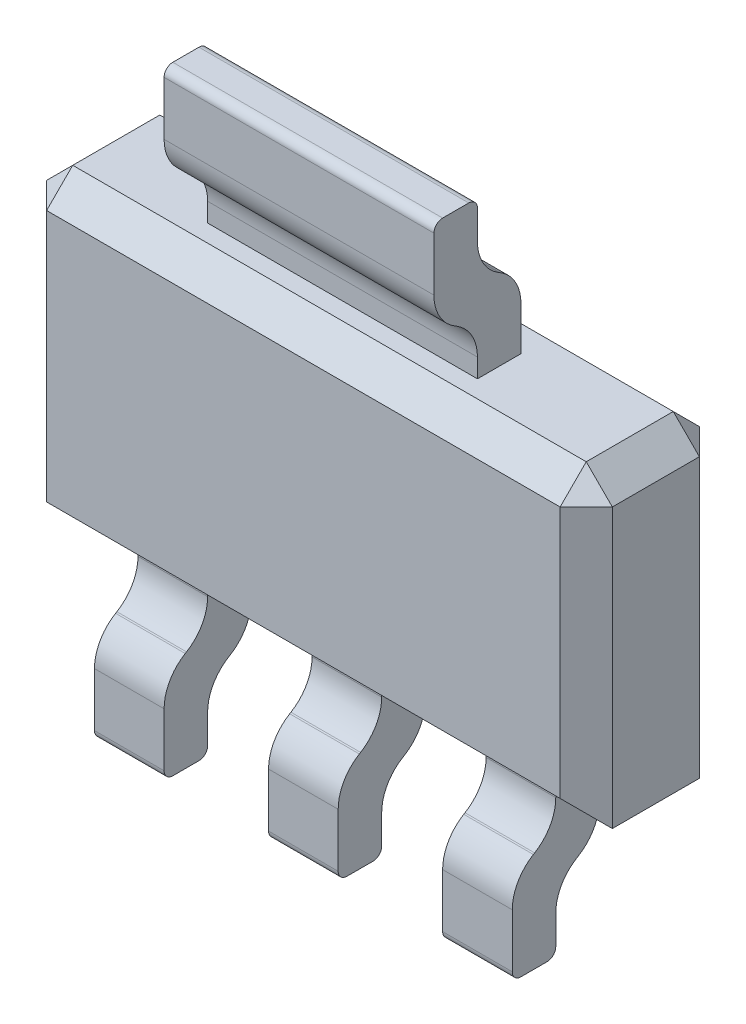
from build123d import *

# Parameters (mm, degrees)
SKETCH1_W                = 6.5
SKETCH1_H                = 3.5
BOSS_EXTRUDE1_DEPTH      = 1.6
CHAMFER1_SIZE            = 0.3
BOSS_EXTRUDE2_DEPTH      = 1.5
BOSS_EXTRUDE2_DEPTH_BACK = 1.6
BOSS_EXTRUDE3_DEPTH      = 0.4
LPATTERN1_COUNT          = 2
LPATTERN1_PITCH          = 2
LPATTERN1_COL_COUNT      = 2
LPATTERN1_COL_PITCH      = 2
CUT_EXTRUDE1_DEPTH       = 0.1


with BuildPart() as part:
    # Sketch1 → Boss-Extrude1 (new body)
    with BuildSketch(Plane.XY):
        Rectangle(SKETCH1_W, SKETCH1_H)
    extrude(amount=BOSS_EXTRUDE1_DEPTH)

    # Chamfer1
    chamfer1_edges = [part.edges().sort_by_distance(p)[0] for p in [
        (-3.25, 0, 1.6),
        (0, -1.75, 1.6),
        (3.25, 0, 1.6),
        (0, -1.75, 0),
        (-3.25, 0, 0),
        (0, 1.75, 0),
        (3.25, 0, 0),
        (0, 1.75, 1.6),
        (-3.25, 1.75, 0.8),
        (3.25, 1.75, 0.8),
    ]]
    chamfer(chamfer1_edges, length=CHAMFER1_SIZE)

    # Sketch2 → Boss-Extrude2 (add, two sides: drawn at the far end of the back side and taken through both)
    with BuildSketch(Plane(origin=(0, 0, 0), x_dir=(0, 0, -1), z_dir=(1, 0, 0)).offset(-BOSS_EXTRUDE2_DEPTH_BACK)):
        with BuildLine():
            Line((-1.1, 1.75), (-1.1, 1.966904811))
            ThreePointArc((-1.1, 1.966904811), (-1.164900047, 2.213254218), (-1.342752122, 2.395651273))
            Line((-1.342752122, 2.395651273), (-1.357247878, 2.404348727))
            ThreePointArc((-1.357247878, 2.404348727), (-1.535099953, 2.586745782), (-1.6, 2.833095189))
            Line((-1.6, 2.833095189), (-1.6, 3.45))
            ThreePointArc((-1.6, 3.45), (-1.570710678, 3.520710678), (-1.5, 3.55))
            Line((-1.5, 3.55), (-1.2, 3.55))
            ThreePointArc((-1.2, 3.55), (-1.129289322, 3.520710678), (-1.1, 3.45))
            Line((-1.1, 3.45), (-1.1, 3.116190379))
            ThreePointArc((-1.1, 3.116190379), (-1.035099953, 2.869840971), (-0.857247878, 2.687443916))
            Line((-0.857247878, 2.687443916), (-0.842752122, 2.678746463))
            ThreePointArc((-0.842752122, 2.678746463), (-0.664900047, 2.496349407), (-0.6, 2.25))
            Line((-0.6, 2.25), (-0.6, 1.75))
            Line((-0.6, 1.75), (-0.3, 1.75))
            Line((-0.3, 1.75), (-0.3, 1.45))
            Line((-0.3, 1.45), (-1.3, 1.45))
            Line((-1.3, 1.45), (-1.3, 1.75))
            Line((-1.3, 1.75), (-1.1, 1.75))
        make_face()
    extrude(amount=BOSS_EXTRUDE2_DEPTH + BOSS_EXTRUDE2_DEPTH_BACK)

    # Sketch3 → Boss-Extrude3 (add, symmetric)
    with BuildSketch(Plane(origin=(0, 0, 0), x_dir=(0, 0, -1), z_dir=(1, 0, 0))):
        with BuildLine():
            Line((-1.1, -1.75), (-1.1, -1.966904811))
            ThreePointArc((-1.1, -1.966904811), (-1.164900047, -2.213254218), (-1.342752122, -2.395651273))
            Line((-1.342752122, -2.395651273), (-1.357247878, -2.404348727))
            ThreePointArc((-1.357247878, -2.404348727), (-1.535099953, -2.586745782), (-1.6, -2.833095189))
            Line((-1.6, -2.833095189), (-1.6, -3.45))
            ThreePointArc((-1.6, -3.45), (-1.570710678, -3.520710678), (-1.5, -3.55))
            Line((-1.5, -3.55), (-1.2, -3.55))
            ThreePointArc((-1.2, -3.55), (-1.129289322, -3.520710678), (-1.1, -3.45))
            Line((-1.1, -3.45), (-1.1, -3.116190379))
            ThreePointArc((-1.1, -3.116190379), (-1.035099953, -2.869840971), (-0.857247878, -2.687443916))
            Line((-0.857247878, -2.687443916), (-0.842752122, -2.678746463))
            ThreePointArc((-0.842752122, -2.678746463), (-0.664900047, -2.496349407), (-0.6, -2.25))
            Line((-0.6, -2.25), (-0.6, -1.75))
            Line((-0.6, -1.75), (-1.1, -1.75))
        make_face()
    boss_extrude3 = extrude(amount=BOSS_EXTRUDE3_DEPTH, both=True)

    # LPattern1: Boss-Extrude3 ×2
    with Locations(*[(-i * LPATTERN1_PITCH, 0, 0) for i in range(1, LPATTERN1_COUNT)]):
        add(boss_extrude3)

    # LPattern1 col: Boss-Extrude3 ×2
    with Locations(*[(i * LPATTERN1_COL_PITCH, 0, 0) for i in range(1, LPATTERN1_COL_COUNT)]):
        add(boss_extrude3)

    # Sketch4 → Cut-Extrude1 (cut)
    # profile 1 of 3: a face of its own
    with BuildSketch(Plane(origin=(0, 0, 0), x_dir=(-1, 0, 0), z_dir=(0, 0, -1))):
        with BuildLine():
            Line((-1.920472746, 0.924352242), (-2.014423067, 0.900714422))
            add(Edge.make_bspline(
                [(-2.014423067, 0.900714422), (-2.018053046, 0.912054357), (-2.025111092, 0.93410346), (-2.040568495, 0.964324102), (-2.059024038, 0.991052392), (-2.080966519, 1.013296323), (-2.1044605, 1.031668686), (-2.129642594, 1.044767543), (-2.155798345, 1.053058927), (-2.173752902, 1.054061436), (-2.182692297, 1.054560576)],
                knots=[0, 0, 0, 0, 1.168138113, 2.271300134, 3.321476528, 4.346768605, 5.329559432, 6.239186739, 7.123308644, 8, 8, 8, 8], degree=3))
            add(Edge.make_bspline(
                [(-2.182692297, 1.054560576), (-2.192290177, 1.054141307), (-2.210781227, 1.053333553), (-2.237171964, 1.045888813), (-2.260579997, 1.033425423), (-2.280956367, 1.016495123), (-2.297588321, 0.995460723), (-2.309522926, 0.970722434), (-2.316634807, 0.942704764), (-2.3174726, 0.922992973), (-2.317908643, 0.912733653)],
                knots=[0, 0, 0, 0, 1.043714073, 2.010795094, 2.957588731, 3.913030843, 4.876275313, 5.855370223, 6.883792733, 8, 8, 8, 8], degree=3))
            add(Edge.make_bspline(
                [(-2.317908643, 0.912733653), (-2.317466896, 0.903065292), (-2.316563943, 0.88330269), (-2.308181798, 0.853709034), (-2.295865359, 0.823368282), (-2.284143225, 0.804013032), (-2.278044861, 0.793943589)],
                knots=[0, 0, 0, 0, 0.912130671, 1.864439786, 2.888988639, 4, 4, 4, 4], degree=3))
            add(Edge.make_bspline(
                [(-2.278044861, 0.793943589), (-2.275689217, 0.790436093), (-2.270524029, 0.782745258), (-2.261010171, 0.771085848), (-2.249525867, 0.757919994), (-2.235643188, 0.743664147), (-2.219813549, 0.727772525), (-2.201805996, 0.710577359), (-2.181500701, 0.692153222), (-2.167152218, 0.679540093), (-2.159655438, 0.672949999)],
                knots=[0, 0, 0, 0, 0.597245862, 1.309572666, 2.125966471, 3.067694609, 4.122725663, 5.298253607, 6.588394528, 8, 8, 8, 8], degree=3))
            add(Edge.make_bspline(
                [(-2.159655438, 0.672949999), (-2.151825351, 0.666093193), (-2.136564817, 0.652729548), (-2.114529063, 0.632828151), (-2.094865422, 0.612788822), (-2.076849785, 0.593247778), (-2.060720046, 0.57415128), (-2.046250434, 0.555407585), (-2.033965816, 0.536838478), (-2.019870998, 0.513114842), (-2.006112773, 0.483521307), (-1.993567079, 0.448116153), (-1.986051126, 0.412849694), (-1.985061379, 0.38939606), (-1.98457531, 0.377877883)],
                knots=[0, 0, 0, 0, 1.057298263, 2.060632975, 3.015088764, 3.908006679, 4.759977002, 5.553599515, 6.311732905, 7.020175599, 8.355208789, 9.618659249, 10.830513802, 12, 12, 12, 12], degree=3))
            add(Edge.make_bspline(
                [(-1.98457531, 0.377877883), (-1.985106596, 0.365822434), (-1.986167338, 0.341753065), (-1.993855303, 0.306039181), (-2.006674379, 0.271135722), (-2.024236394, 0.237391011), (-2.045854488, 0.205614383), (-2.0715856, 0.177187413), (-2.10063051, 0.152087714), (-2.132935173, 0.131000976), (-2.167479795, 0.11432495), (-2.203295934, 0.101785928), (-2.240349911, 0.094423862), (-2.265459972, 0.093490104), (-2.278044861, 0.093022114)],
                knots=[0, 0, 0, 0, 0.95933445, 1.915364199, 2.894076093, 3.911657741, 4.936406422, 5.945146763, 6.955314745, 7.98443854, 9.006743905, 10.001947279, 10.998597686, 12, 12, 12, 12], degree=3))
            add(Edge.make_bspline(
                [(-2.278044861, 0.093022114), (-2.286000583, 0.093218803), (-2.301694541, 0.093606803), (-2.324857854, 0.0965644), (-2.347343377, 0.100938422), (-2.368804281, 0.108010466), (-2.389628994, 0.116304028), (-2.409467948, 0.126857318), (-2.428638343, 0.139088455), (-2.446819702, 0.153370399), (-2.464102575, 0.169335179), (-2.479969041, 0.187326333), (-2.494561349, 0.20700894), (-2.508105807, 0.228389138), (-2.520257146, 0.251585637), (-2.531011757, 0.276543729), (-2.540779056, 0.303128874), (-2.545998956, 0.321681674), (-2.548677874, 0.331203204)],
                knots=[0, 0, 0, 0, 0.976345898, 1.926001569, 2.863264323, 3.783597659, 4.695422112, 5.61209751, 6.537563973, 7.483710594, 8.446542162, 9.422061815, 10.423783928, 11.451726979, 12.526080932, 13.63475611, 14.786127034, 16, 16, 16, 16], degree=3))
            Line((-2.548677874, 0.331203204), (-2.456730759, 0.362252883))
            add(Edge.make_bspline(
                [(-2.456730759, 0.362252883), (-2.454757077, 0.354878913), (-2.450899079, 0.340464859), (-2.443647794, 0.31988382), (-2.435617472, 0.300753805), (-2.426839102, 0.2830147), (-2.417001345, 0.266723681), (-2.406222784, 0.251897805), (-2.394518979, 0.238588939), (-2.382064455, 0.226705239), (-2.368909401, 0.216317091), (-2.355097978, 0.207447462), (-2.340881289, 0.1997551), (-2.326034064, 0.193580251), (-2.310754695, 0.188714392), (-2.29497913, 0.185384706), (-2.278785328, 0.182995427), (-2.267770671, 0.182842683), (-2.262219541, 0.182765704)],
                knots=[0, 0, 0, 0, 1.27452921, 2.49134904, 3.640894228, 4.738128229, 5.793885421, 6.815517018, 7.795391005, 8.749867841, 9.686920353, 10.59018185, 11.488265043, 12.383018393, 13.271844542, 14.16213873, 15.073760765, 16, 16, 16, 16], degree=3))
            add(Edge.make_bspline(
                [(-2.262219541, 0.182765704), (-2.255932234, 0.182895468), (-2.243502045, 0.183152017), (-2.225210759, 0.185926888), (-2.20751026, 0.189999175), (-2.190589074, 0.196159106), (-2.17422896, 0.203754134), (-2.158630431, 0.213220407), (-2.14366073, 0.224339314), (-2.129627592, 0.237063565), (-2.116652654, 0.250922272), (-2.105320553, 0.265902558), (-2.095740323, 0.28168287), (-2.087808124, 0.298234962), (-2.081836789, 0.3156028), (-2.077384024, 0.333689699), (-2.074719298, 0.352624538), (-2.074453827, 0.365516271), (-2.0743189, 0.372068589)],
                knots=[0, 0, 0, 0, 1.015573487, 2.007818686, 2.984381074, 3.947185414, 4.912950098, 5.895934178, 6.891169222, 7.922961954, 8.954076915, 9.955788422, 10.953595741, 11.93373093, 12.916892793, 13.916974552, 14.941287141, 16, 16, 16, 16], degree=3))
            add(Edge.make_bspline(
                [(-2.0743189, 0.372068589), (-2.074726397, 0.381843563), (-2.07554292, 0.401430186), (-2.081522519, 0.430597831), (-2.091747712, 0.459179588), (-2.103338082, 0.482638139), (-2.114868287, 0.501663347), (-2.125798161, 0.516611152), (-2.138496931, 0.532324019), (-2.153124151, 0.548649016), (-2.169569631, 0.565749899), (-2.188113542, 0.583274372), (-2.208274384, 0.601805488), (-2.222708918, 0.613976226), (-2.230168259, 0.620265704)],
                knots=[0, 0, 0, 0, 1.1592625, 2.32287436, 3.515436147, 4.751839471, 5.420264349, 6.152358554, 6.946614454, 7.816295863, 8.751882792, 9.760386089, 10.842633624, 12, 12, 12, 12], degree=3))
            add(Edge.make_bspline(
                [(-2.230168259, 0.620265704), (-2.238089967, 0.627028683), (-2.253346707, 0.640053779), (-2.274643662, 0.659584381), (-2.294186645, 0.677495338), (-2.311334245, 0.694346418), (-2.326556466, 0.709733363), (-2.339271842, 0.724139343), (-2.35007404, 0.737160591), (-2.356147761, 0.745699103), (-2.358974349, 0.749672755)],
                knots=[0, 0, 0, 0, 1.365749921, 2.630353224, 3.788993582, 4.841638642, 5.782843504, 6.62635687, 7.360734032, 8, 8, 8, 8], degree=3))
            add(Edge.make_bspline(
                [(-2.358974349, 0.749672755), (-2.36288707, 0.755888925), (-2.370636004, 0.768199715), (-2.380255929, 0.787490854), (-2.388897994, 0.806778811), (-2.395596574, 0.826468263), (-2.401137986, 0.846368353), (-2.40488162, 0.866545708), (-2.407152489, 0.886973765), (-2.407484851, 0.900641848), (-2.407652233, 0.907525319)],
                knots=[0, 0, 0, 0, 1.051611403, 2.082659569, 3.08504127, 4.077330082, 5.05895629, 6.042072917, 7.013955696, 8, 8, 8, 8], degree=3))
            add(Edge.make_bspline(
                [(-2.407652233, 0.907525319), (-2.40748109, 0.915882516), (-2.407144327, 0.932327154), (-2.403848746, 0.95648253), (-2.398479816, 0.979489969), (-2.391019802, 1.001395225), (-2.381346988, 1.022147159), (-2.369477693, 1.041780342), (-2.355602693, 1.060381663), (-2.339523995, 1.077460079), (-2.322129759, 1.093204157), (-2.303410224, 1.106918671), (-2.283631754, 1.118388866), (-2.262896821, 1.12783035), (-2.241127935, 1.135373727), (-2.218262673, 1.140412717), (-2.194413538, 1.143827407), (-2.178164203, 1.144143073), (-2.169871784, 1.144304166)],
                knots=[0, 0, 0, 0, 1.068512934, 2.102536271, 3.111491677, 4.086581919, 5.057172758, 6.034206305, 7.016452721, 8.019679706, 9.029755231, 10.013782559, 10.982115857, 11.949129822, 12.924220064, 13.922928313, 14.94002146, 16, 16, 16, 16], degree=3))
            add(Edge.make_bspline(
                [(-2.169871784, 1.144304166), (-2.162852669, 1.144167205), (-2.148964809, 1.143896218), (-2.128440401, 1.141219193), (-2.108559514, 1.13676592), (-2.089216657, 1.130783083), (-2.07049593, 1.122937959), (-2.05243975, 1.113169331), (-2.03474303, 1.102061622), (-2.017955318, 1.088921826), (-2.001823258, 1.074308913), (-1.986830938, 1.057855584), (-1.972937345, 1.039667027), (-1.960127007, 1.019849219), (-1.948548649, 0.998287098), (-1.93789872, 0.975239436), (-1.928446514, 0.950458375), (-1.923175195, 0.933200066), (-1.920472746, 0.924352242)],
                knots=[0, 0, 0, 0, 0.937914443, 1.855735748, 2.760970393, 3.658736962, 4.558896516, 5.469352994, 6.400403984, 7.348457424, 8.315152512, 9.307068554, 10.319338604, 11.371590089, 12.457967009, 13.588231173, 14.763557645, 16, 16, 16, 16], degree=3))
        make_face()
    # profile 2 of 3: a face of its own
    with BuildSketch(Plane(origin=(0, 0, 0), x_dir=(-1, 0, 0), z_dir=(0, 0, -1))):
        with BuildLine():
            add(Edge.make_bspline(
                [(-1.208533643, 1.144304166), (-1.192153918, 1.143947402), (-1.159940102, 1.143245758), (-1.112711551, 1.136880493), (-1.067542592, 1.126502467), (-1.02453619, 1.111815895), (-0.983564959, 1.093086727), (-0.944721823, 1.070172173), (-0.908154972, 1.042871172), (-0.873871416, 1.012033749), (-0.842750731, 0.977986135), (-0.81554637, 0.941305879), (-0.79242771, 0.902532268), (-0.773346347, 0.861588251), (-0.759015634, 0.818237912), (-0.74867999, 0.772827742), (-0.741957646, 0.725233343), (-0.741314023, 0.692738176), (-0.740985567, 0.676155127)],
                knots=[0, 0, 0, 0, 1.061681398, 2.087996504, 3.083659545, 4.062660971, 5.02945529, 5.999994507, 6.981138296, 7.983640916, 8.985844288, 9.966988076, 10.939736476, 11.908342154, 12.890058995, 13.894159216, 14.925339913, 16, 16, 16, 16], degree=3))
            add(Edge.make_bspline(
                [(-0.740985567, 0.676155127), (-0.741083848, 0.665935543), (-0.74127804, 0.645743082), (-0.743347235, 0.615724743), (-0.746771544, 0.586393541), (-0.751310137, 0.557622941), (-0.757405926, 0.529576471), (-0.764534794, 0.502056693), (-0.773233329, 0.475223348), (-0.783001472, 0.448902185), (-0.794240606, 0.423221054), (-0.806917199, 0.398203926), (-0.820720712, 0.373675453), (-0.835988162, 0.349815732), (-0.85258392, 0.326623926), (-0.87055947, 0.304076969), (-0.889682531, 0.282094482), (-0.91016461, 0.26093135), (-0.931404851, 0.24051472), (-0.953650422, 0.221591714), (-0.976401607, 0.203825095), (-0.999807149, 0.18734151), (-1.02407388, 0.172441509), (-1.048808868, 0.1584971), (-1.074149708, 0.145833994), (-1.100325769, 0.134891289), (-1.127042558, 0.125010362), (-1.154377965, 0.116416235), (-1.182408041, 0.109205625), (-1.211064477, 0.103145228), (-1.240424747, 0.098574462), (-1.270446388, 0.095429283), (-1.301050973, 0.093305341), (-1.321711098, 0.093117071), (-1.3321314, 0.093022114)],
                knots=[0, 0, 0, 0, 1.057694632, 2.089855924, 3.112648636, 4.113725536, 5.103331559, 6.082381806, 7.055068159, 8.021768845, 8.98743121, 9.954922249, 10.923671581, 11.89959402, 12.885451751, 13.874212627, 14.883322035, 15.900071676, 16.921812937, 17.931632203, 18.921551953, 19.909055848, 20.892997665, 21.867769094, 22.84762411, 23.823252803, 24.802912784, 25.795362855, 26.787788858, 27.797679081, 28.826061376, 29.861826465, 30.921574152, 32, 32, 32, 32], degree=3))
            add(Edge.make_bspline(
                [(-1.3321314, 0.093022114), (-1.349642351, 0.093394552), (-1.38383724, 0.094121838), (-1.433753596, 0.10014769), (-1.480901497, 0.110492705), (-1.525581711, 0.124325057), (-1.567458259, 0.142683977), (-1.606602714, 0.165058307), (-1.643047551, 0.191473062), (-1.676663321, 0.221650255), (-1.706766005, 0.255246096), (-1.733238901, 0.291402912), (-1.75533993, 0.33025565), (-1.773765512, 0.371449844), (-1.78758891, 0.415337113), (-1.797949145, 0.46147782), (-1.803983904, 0.510196097), (-1.804714519, 0.54352629), (-1.805088131, 0.560570191)],
                knots=[0, 0, 0, 0, 1.121422378, 2.189881799, 3.214223923, 4.209829567, 5.180887389, 6.136870002, 7.092517675, 8.058664933, 9.02481219, 9.976998316, 10.923432162, 11.882748215, 12.86205079, 13.865508147, 14.908495107, 16, 16, 16, 16], degree=3))
            add(Edge.make_bspline(
                [(-1.805088131, 0.560570191), (-1.804862696, 0.57386669), (-1.804415521, 0.600241868), (-1.800668715, 0.6393789), (-1.794771746, 0.677753729), (-1.78605487, 0.715184623), (-1.775198849, 0.751857249), (-1.762082021, 0.787747684), (-1.74607201, 0.822623234), (-1.728112529, 0.856656192), (-1.708063501, 0.889432293), (-1.685595568, 0.920249157), (-1.661901132, 0.949697795), (-1.635821075, 0.976991458), (-1.608077334, 1.002581912), (-1.578454629, 1.026381709), (-1.546949479, 1.048196575), (-1.513736648, 1.068147783), (-1.479249453, 1.086239859), (-1.443406375, 1.10159501), (-1.406719959, 1.114890288), (-1.368997653, 1.125781287), (-1.330196563, 1.133879079), (-1.290549286, 1.139917543), (-1.249870697, 1.143635063), (-1.222430336, 1.144079227), (-1.208533643, 1.144304166)],
                knots=[0, 0, 0, 0, 1.027038055, 2.037251559, 3.03463374, 4.024476576, 5.003805404, 5.987972729, 6.973761106, 7.966047439, 8.95963362, 9.938921687, 10.910571097, 11.877553313, 12.852319973, 13.824735949, 14.81069978, 15.81041387, 16.816403723, 17.816876174, 18.82042938, 19.829469955, 20.847307225, 21.880377804, 22.926554263, 24, 24, 24, 24], degree=3))
        make_face()
        with BuildLine():
            add(Edge.make_bspline(
                [(-1.208533643, 1.054560576), (-1.220493784, 1.054381239), (-1.244118554, 1.054026997), (-1.27907669, 1.050814008), (-1.313121298, 1.046259625), (-1.346097913, 1.039002622), (-1.378196999, 1.030434286), (-1.409128115, 1.019166435), (-1.439254695, 1.006459786), (-1.468264304, 0.991588943), (-1.496061101, 0.975033698), (-1.522450747, 0.95671571), (-1.547298691, 0.936707425), (-1.570578139, 0.914876579), (-1.592682637, 0.891790628), (-1.612984908, 0.866717273), (-1.631798037, 0.840047671), (-1.649117307, 0.811945718), (-1.66475672, 0.782830244), (-1.678131144, 0.752920067), (-1.689584684, 0.722622333), (-1.699078425, 0.691942366), (-1.70628444, 0.660729685), (-1.711444109, 0.629079482), (-1.714834514, 0.59690193), (-1.715173737, 0.575268898), (-1.715344541, 0.564376281)],
                knots=[0, 0, 0, 0, 1.093710758, 2.16039807, 3.20900896, 4.233234191, 5.246749975, 6.245527847, 7.241594159, 8.235879922, 9.224691631, 10.198908654, 11.171861231, 12.139893662, 13.116290872, 14.093089164, 15.087825051, 16.099756899, 17.110766713, 18.108591704, 19.094380672, 20.071961556, 21.043859171, 22.021859724, 23.00397114, 24, 24, 24, 24], degree=3))
            add(Edge.make_bspline(
                [(-1.715344541, 0.564376281), (-1.715173631, 0.555224573), (-1.714835062, 0.537095275), (-1.712652377, 0.510258655), (-1.708798005, 0.484186213), (-1.703622175, 0.4588095), (-1.696840091, 0.434163599), (-1.688327829, 0.410260295), (-1.678549981, 0.387024296), (-1.667359516, 0.364577147), (-1.654734144, 0.343187591), (-1.640962914, 0.322912249), (-1.625893301, 0.304090416), (-1.609786127, 0.286528331), (-1.592496796, 0.270281563), (-1.574089626, 0.255187561), (-1.5543554, 0.241637341), (-1.533701958, 0.229099272), (-1.511924125, 0.218142888), (-1.489141658, 0.208695599), (-1.465445394, 0.200690773), (-1.440839045, 0.194052778), (-1.415254506, 0.189087467), (-1.388769472, 0.185503064), (-1.361349851, 0.183256491), (-1.34275265, 0.18293071), (-1.333333323, 0.182765704)],
                knots=[0, 0, 0, 0, 1.083699529, 2.146780792, 3.185591126, 4.202843058, 5.211856999, 6.209655863, 7.20532214, 8.195415879, 9.177202942, 10.14436246, 11.095191523, 12.029705806, 12.963818608, 13.902338257, 14.845476191, 15.796042213, 16.761390084, 17.729066592, 18.714222808, 19.721158958, 20.74459932, 21.797962164, 22.884686177, 24, 24, 24, 24], degree=3))
            add(Edge.make_bspline(
                [(-1.333333323, 0.182765704), (-1.322039066, 0.182927727), (-1.299670995, 0.183248611), (-1.266454534, 0.186745439), (-1.233814953, 0.19151239), (-1.201813807, 0.198925005), (-1.1703512, 0.207972669), (-1.139688252, 0.219601358), (-1.109469597, 0.232725744), (-1.080174992, 0.248209298), (-1.051832626, 0.265233579), (-1.025061194, 0.28421492), (-0.999855191, 0.304711994), (-0.975820929, 0.326446158), (-0.953886482, 0.350229724), (-0.933266648, 0.375392613), (-0.914326815, 0.402209805), (-0.896901893, 0.430425662), (-0.881325631, 0.459712501), (-0.867899727, 0.489867075), (-0.856454598, 0.52057444), (-0.846999153, 0.551800815), (-0.839764948, 0.583674134), (-0.834633066, 0.616063313), (-0.831231672, 0.649106232), (-0.830897764, 0.671338954), (-0.830729156, 0.682565383)],
                knots=[0, 0, 0, 0, 1.029812959, 2.039525905, 3.043952503, 4.036919093, 5.033391511, 6.027870106, 7.026035071, 8.036794627, 9.047957848, 10.039952554, 11.027355318, 12.010276797, 12.992858524, 13.975534638, 14.976019862, 15.985163142, 16.99876328, 17.999396818, 18.993875413, 19.986244033, 20.973271002, 21.972624612, 22.976275263, 24, 24, 24, 24], degree=3))
            add(Edge.make_bspline(
                [(-0.830729156, 0.682565383), (-0.83112323, 0.697139126), (-0.83189475, 0.725671702), (-0.837659328, 0.767358418), (-0.847828669, 0.806561926), (-0.861360219, 0.843664469), (-0.879353853, 0.878228345), (-0.901201939, 0.910534102), (-0.926858117, 0.940707219), (-0.9468191, 0.958305678), (-0.956931079, 0.967220832)],
                knots=[0, 0, 0, 0, 1.085318323, 2.124844004, 3.126009127, 4.096923137, 5.060061729, 6.020100862, 6.997008382, 8, 8, 8, 8], degree=3))
            add(Edge.make_bspline(
                [(-0.956931079, 0.967220832), (-0.965757432, 0.974199385), (-0.983322875, 0.988087497), (-1.011688538, 1.005841304), (-1.04122871, 1.020975587), (-1.072163023, 1.03326103), (-1.104400939, 1.042877397), (-1.137989156, 1.04966224), (-1.172842547, 1.053737995), (-1.196503403, 1.054283312), (-1.208533643, 1.054560576)],
                knots=[0, 0, 0, 0, 0.992364662, 1.974918139, 2.947382948, 3.917989177, 4.907989082, 5.912266894, 6.938502841, 8, 8, 8, 8], degree=3))
        make_face(mode=Mode.SUBTRACT)
    # profile 3 of 3: a face of its own
    with BuildSketch(Plane(origin=(0, 0, 0), x_dir=(-1, 0, 0), z_dir=(0, 0, -1))):
        Polygon((-0.599959926, 1.11866314), (-0.010216336, 1.11866314), (-0.023036849, 1.02891955), (-0.267427874, 1.02891955), (-0.394230759, 0.11866314), (-0.48457531, 0.11866314), (-0.357772426, 1.02891955), (-0.612780438, 1.02891955), align=None)
    extrude(amount=-CUT_EXTRUDE1_DEPTH, mode=Mode.SUBTRACT)


solid = part.part
